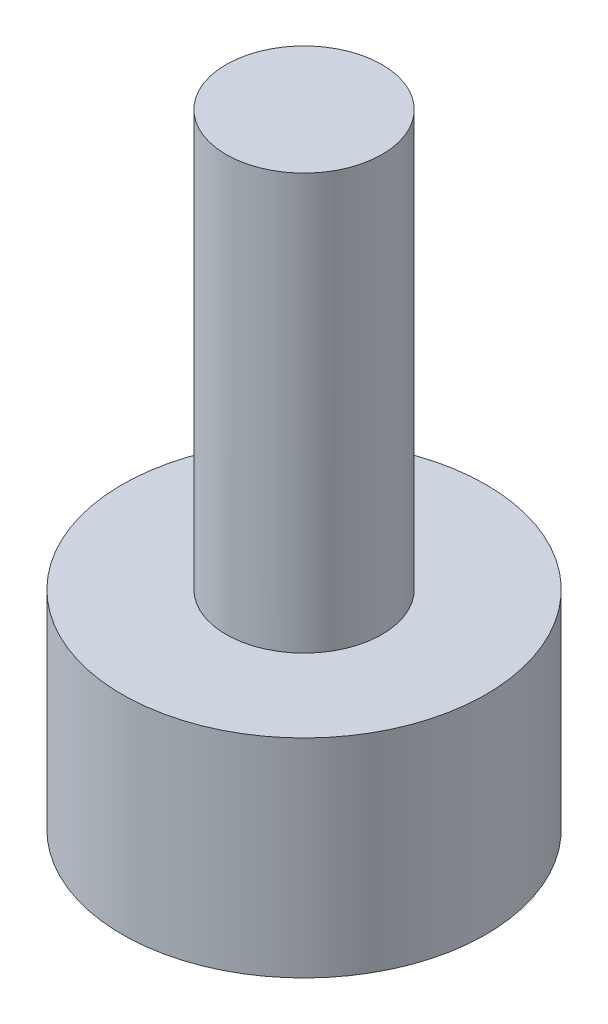
from build123d import *

# Parameters (mm, degrees)
SKETCH_1_R      = 6
EXTRUDE_1_DEPTH = 32
SKETCH_3_R      = 14
SKETCH_3_R_2    = 2.5
EXTRUDE_2_DEPTH = 16


with BuildPart() as part:
    # 草图1 → 凸台-拉伸1 (new body)
    with BuildSketch(Plane(origin=(0, 0, 0), x_dir=(1, 0, 0), z_dir=(0, 1, 0))):
        with Locations(Location((0, 0, 0), (0, 0, 270))):
            Circle(SKETCH_1_R)
    extrude(amount=EXTRUDE_1_DEPTH)

    # 草图3 → 凸台-拉伸2 (add)
    with BuildSketch(Plane.XZ):
        with Locations(Location((0, 0, 0), (0, 0, 270))):
            Circle(SKETCH_3_R)
        with Locations(Location((0, 0, 0), (0, 0, 270))):
            Circle(SKETCH_3_R_2, mode=Mode.SUBTRACT)
    extrude(amount=EXTRUDE_2_DEPTH)


solid = part.part
